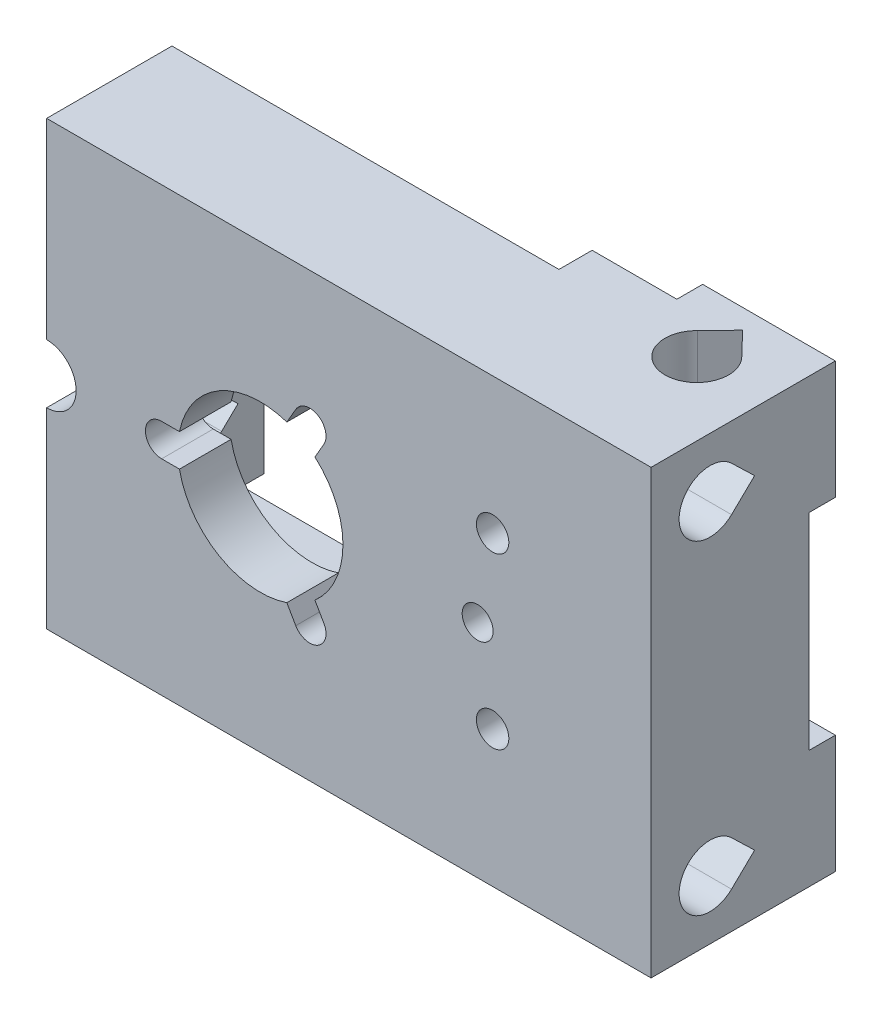
from build123d import *

# Parameters (mm, degrees)
SKETCH1_W           = 60
SKETCH1_H           = 25
BOSS_EXTRUDE1_DEPTH = 82
CUT_EXTRUDE7_DEPTH  = 3.5
SKETCH50_W          = 52.5
SKETCH50_H          = 4.5
CUT_EXTRUDE9_DEPTH  = 80.605527446
SKETCH51_W          = 9.5
SKETCH51_H          = 34
BOSS_EXTRUDE2_DEPTH = 3
SKETCH52_W          = 43
SKETCH52_H          = 34
CUT_EXTRUDE10_DEPTH = 10
CUT_EXTRUDE11_DEPTH = 4
CUT_EXTRUDE12_DEPTH = 4
CUT_EXTRUDE13_DEPTH = 3.5
CUT_EXTRUDE14_DEPTH = 3.5
CUT_EXTRUDE15_DEPTH = 88.408752422
CUT_EXTRUDE16_DEPTH = 59.086142926
CUT_EXTRUDE17_DEPTH = 88.408752422
CUT_EXTRUDE18_DEPTH = 15
HOLE1_D             = 4.2
HOLE2_D             = 4.4
HOLE3_D             = 4.4
HOLE4_D             = 8
SKETCH125_W         = 5.08
SKETCH125_H         = 27.94
CUT_EXTRUDE19_DEPTH = 3.556
SKETCH126_W         = 9.92
SKETCH126_H         = 28.017689761
CUT_EXTRUDE20_DEPTH = 20.066
CUT_EXTRUDE21_DEPTH = 80.605527446


with BuildPart() as part:
    # Sketch1 → Boss-Extrude1 (new body)
    with BuildSketch(Plane(origin=(-39, 0, 0), x_dir=(0, -1, 0), z_dir=(-1, 0, 0))):
        with Locations((0, 17.3)):
            Rectangle(SKETCH1_W, SKETCH1_H)
        with BuildLine():
            Line((22, 15.753862534), (18.978772839, 18.882434844))
            ThreePointArc((18.978772839, 18.882434844), (22, 26), (25.021227161, 18.882434844))
            Line((25.021227161, 18.882434844), (22, 15.753862534))
        make_face(mode=Mode.SUBTRACT)
        with BuildLine():
            Line((-18.978772839, 18.882434844), (-22, 15.753862534))
            Line((-22, 15.753862534), (-25.021227161, 18.882434844))
            ThreePointArc((-25.021227161, 18.882434844), (-22, 26), (-18.978772839, 18.882434844))
        make_face(mode=Mode.SUBTRACT)
    extrude(amount=-BOSS_EXTRUDE1_DEPTH)

    # Sketch39 → Cut-Extrude7 (cut)
    with BuildSketch(Plane(origin=(0, 0, 4.8), x_dir=(-1, 0, 0), z_dir=(0, 0, -1))):
        Polygon((-28, 14), (-28, -14), (-25, -14), (-25, -30), (39, -30), (39, 30), (-25, 30), (-25, 14), align=None)
    extrude(amount=-CUT_EXTRUDE7_DEPTH, mode=Mode.SUBTRACT)

    # Sketch50 → Cut-Extrude9 (cut, through all)
    with BuildSketch(Plane.XZ.offset(30)):
        with Locations((-12.75, 10.55)):
            Rectangle(SKETCH50_W, SKETCH50_H)
    extrude(amount=-CUT_EXTRUDE9_DEPTH, mode=Mode.SUBTRACT)

    # Sketch51 → Boss-Extrude2 (add)
    with BuildSketch(Plane(origin=(0, 0, 12.8), x_dir=(-1, 0, 0), z_dir=(0, 0, -1))):
        with Locations((34.25, 0)):
            Rectangle(SKETCH51_W, SKETCH51_H)
    extrude(amount=BOSS_EXTRUDE2_DEPTH)

    # Sketch52 → Cut-Extrude10 (cut)
    with BuildSketch(Plane(origin=(0, 0, 12.8), x_dir=(-1, 0, 0), z_dir=(0, 0, -1))):
        with Locations((8, 0)):
            Rectangle(SKETCH52_W, SKETCH52_H)
    extrude(amount=-CUT_EXTRUDE10_DEPTH, mode=Mode.SUBTRACT)

    # Sketch63 → Cut-Extrude11 (cut)
    with BuildSketch(Plane(origin=(-29.5, 0, 0), x_dir=(0, 0, -1), z_dir=(1, 0, 0))):
        Polygon((-22.8, 4.892671517), (-19.15, 2.785343035), (-15.559049818, 4.858579089), (-13.34154355, 7), (-15.559049818, 9.141420911), (-19.15, 11.214656965), (-22.8, 9.107328483), align=None)
    extrude(amount=-CUT_EXTRUDE11_DEPTH, mode=Mode.SUBTRACT)

    # Sketch75 → Cut-Extrude12 (cut)
    with BuildSketch(Plane(origin=(-29.5, 0, 0), x_dir=(0, 0, -1), z_dir=(1, 0, 0))):
        Polygon((-15.559049818, -4.858579089), (-19.15, -2.785343035), (-22.8, -4.892671517), (-22.8, -9.107328483), (-19.15, -11.214656965), (-15.559049818, -9.141420911), (-13.34154355, -7), align=None)
    extrude(amount=-CUT_EXTRUDE12_DEPTH, mode=Mode.SUBTRACT)

    # Sketch76 → Cut-Extrude13 (cut)
    with BuildSketch(Plane(origin=(0, 0, 4.8), x_dir=(-1, 0, 0), z_dir=(0, 0, -1))):
        with BuildLine():
            Line((-25, -18.693747285), (-25, -14))
            Line((-25, -14), (-29.099342077, -14))
            ThreePointArc((-29.099342077, -14), (-27.525501185, -16.762445769), (-25, -18.693747285))
        make_face()
    extrude(amount=-CUT_EXTRUDE13_DEPTH, mode=Mode.SUBTRACT)

    # Sketch77 → Cut-Extrude14 (cut)
    with BuildSketch(Plane(origin=(0, 0, 4.8), x_dir=(-1, 0, 0), z_dir=(0, 0, -1))):
        with BuildLine():
            Line((-29.099342077, 14), (-25, 14))
            Line((-25, 14), (-25, 18.693747285))
            ThreePointArc((-25, 18.693747285), (-27.525501185, 16.762445769), (-29.099342077, 14))
        make_face()
    extrude(amount=-CUT_EXTRUDE14_DEPTH, mode=Mode.SUBTRACT)

    # Sketch89 → Cut-Extrude15 (cut, through all)
    with BuildSketch(Plane(origin=(-33.5, 0, 0), x_dir=(0, 0, -1), z_dir=(1, 0, 0))):
        with BuildLine():
            Line((-15.982975613, 7), (-17.621751585, 8.582547561))
            ThreePointArc((-17.621751585, 8.582547561), (-21.35, 7), (-17.621751585, 5.417452439))
            Line((-17.621751585, 5.417452439), (-15.982975613, 7))
        make_face()
    extrude(amount=-CUT_EXTRUDE15_DEPTH, mode=Mode.SUBTRACT)

    # Sketch90 → Cut-Extrude16 (cut, through all)
    with BuildSketch(Plane.XY.offset(29.8)):
        with BuildLine():
            Line((-23.4, -2.2), (-20.981803131, -2.2))
            ThreePointArc((-20.981803131, -2.2), (-15.6, -9.699484522), (-6.414354323, -10.61052049))
            Line((-6.414354323, -10.61052049), (-5.205255888, -12.704740411))
            ThreePointArc((-5.205255888, -12.704740411), (-2.2, -13.509996299), (-1.394744112, -10.504740411))
            Line((-1.394744112, -10.504740411), (-2.603842546, -8.41052049))
            ThreePointArc((-2.603842546, -8.41052049), (1.2, 0), (-2.603842546, 8.41052049))
            Line((-2.603842546, 8.41052049), (-1.394744112, 10.504740411))
            ThreePointArc((-1.394744112, 10.504740411), (-2.2, 13.509996299), (-5.205255888, 12.704740411))
            Line((-5.205255888, 12.704740411), (-6.414354323, 10.61052049))
            ThreePointArc((-6.414354323, 10.61052049), (-15.6, 9.699484522), (-20.981803131, 2.2))
            Line((-20.981803131, 2.2), (-23.4, 2.2))
            ThreePointArc((-23.4, 2.2), (-25.6, 0), (-23.4, -2.2))
        make_face()
    extrude(amount=-CUT_EXTRUDE16_DEPTH, mode=Mode.SUBTRACT)

    # Sketch103 → Cut-Extrude17 (cut, through all)
    with BuildSketch(Plane(origin=(-33.5, 0, 0), x_dir=(0, 0, -1), z_dir=(1, 0, 0))):
        with BuildLine():
            Line((-17.621751585, -8.582547561), (-15.982975613, -7))
            Line((-15.982975613, -7), (-17.621751585, -5.417452439))
            ThreePointArc((-17.621751585, -5.417452439), (-21.35, -7), (-17.621751585, -8.582547561))
        make_face()
    extrude(amount=-CUT_EXTRUDE17_DEPTH, mode=Mode.SUBTRACT)

    # Sketch116 → Cut-Extrude18 (cut)
    with BuildSketch(Plane(origin=(0, 0, 8.3), x_dir=(-1, 0, 0), z_dir=(0, 0, -1))):
        Polygon((-19.5, 4.214656965), (-23.090950182, 2.141420911), (-23.090950182, -2.141420911), (-19.5, -4.214656965), (-15.85, -2.107328483), (-15.85, 2.107328483), align=None)
    extrude(amount=-CUT_EXTRUDE18_DEPTH, mode=Mode.SUBTRACT)

    # Hole1 (through all)
    with Locations(Plane(origin=(0, 0, 23.3), x_dir=(-1, 0, 0), z_dir=(0, 0, -1))):
        with Locations((-19.470475091, 0.017046214)):
            Hole(HOLE1_D / 2)

    # Hole2 (through all)
    with Locations(Plane(origin=(0, 0, 8.3), x_dir=(-1, 0, 0), z_dir=(0, 0, -1))):
        with Locations((-21.5, 11.5)):
            Hole(HOLE2_D / 2)

    # Hole3 (through all)
    with Locations(Plane(origin=(0, 0, 8.3), x_dir=(-1, 0, 0), z_dir=(0, 0, -1))):
        with Locations((-21.5, -11.5)):
            Hole(HOLE3_D / 2)

    # Hole4 (through all)
    with Locations(Plane(origin=(0, 0, 9.8), x_dir=(-1, 0, 0), z_dir=(0, 0, -1))):
        with Locations((39, 0)):
            Hole(HOLE4_D / 2)

    # Sketch125 → Cut-Extrude19 (cut)
    with BuildSketch(Plane(origin=(0, 0, 4.8), x_dir=(-1, 0, 0), z_dir=(0, 0, -1))):
        with Locations((-40.46, 0)):
            Rectangle(SKETCH125_W, SKETCH125_H)
    extrude(amount=-CUT_EXTRUDE19_DEPTH, mode=Mode.SUBTRACT)

    # Sketch126 → Cut-Extrude20 (cut)
    with BuildSketch(Plane(origin=(0, 0, 4.8), x_dir=(-1, 0, 0), z_dir=(0, 0, -1))):
        with Locations((-32.96, 0.008844881)):
            Rectangle(SKETCH126_W, SKETCH126_H)
    extrude(amount=-CUT_EXTRUDE20_DEPTH, mode=Mode.SUBTRACT)

    # Sketch128 → Cut-Extrude21 (cut, through all)
    with BuildSketch(Plane(origin=(0, 30, 0), x_dir=(1, 0, 0), z_dir=(0, 1, 0))):
        with BuildLine():
            Line((30.094465156, -10.583890742), (33.094, -7.477781484))
            Line((33.094, -7.477781484), (36.093534844, -10.583890742))
            ThreePointArc((36.093534844, -10.583890742), (33.094, -18.008), (30.094465156, -10.583890742))
        make_face()
    extrude(amount=-CUT_EXTRUDE21_DEPTH, mode=Mode.SUBTRACT)


solid = part.part
